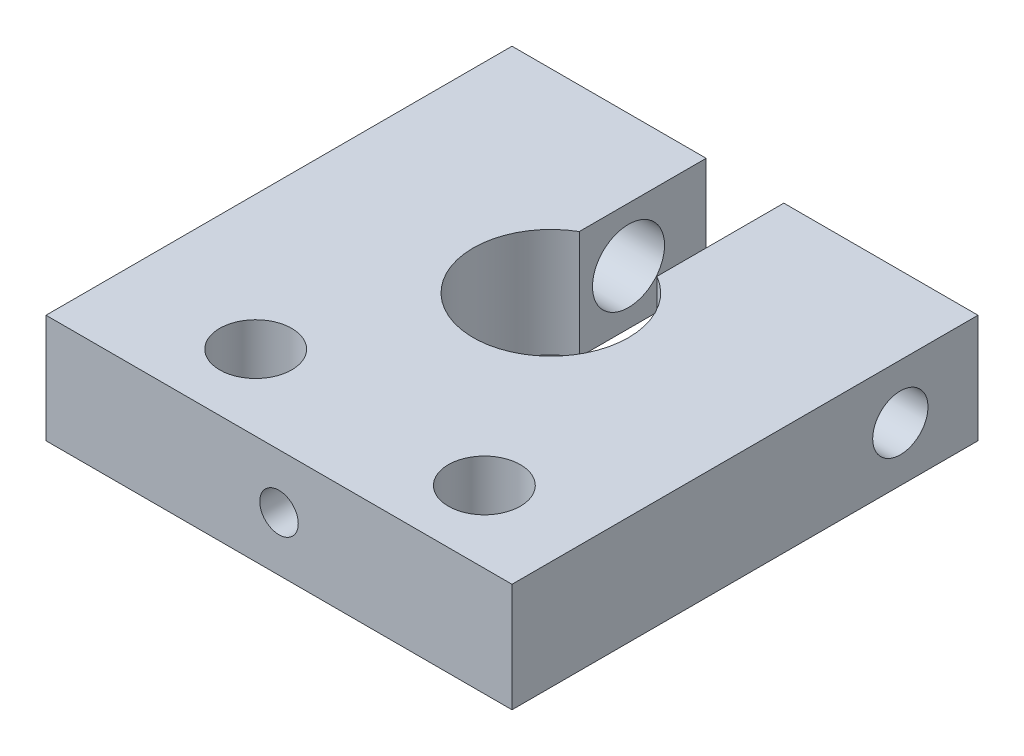
from build123d import *

# Parameters (mm, degrees)
SKETCH1_W           = 19.05
SKETCH1_H           = 19.05
SKETCH1_R           = 3.175
BOSS_EXTRUDE1_DEPTH = 4.445
SKETCH2_R           = 1.4732
SKETCH2_W           = 3.175
SKETCH2_H           = 5.187869343
CUT_EXTRUDE1_DEPTH  = 16.296120627
SKETCH4_R           = 0.7874
CUT_EXTRUDE3_DEPTH  = 22.757438958
SKETCH6_R           = 1.1303
CUT_EXTRUDE5_DEPTH  = 16.296120729
SKETCH7_R           = 1.4732
CUT_EXTRUDE6_DEPTH  = 16.296120729


with BuildPart() as part:
    # Sketch1 → Boss-Extrude1 (new body)
    with BuildSketch(Plane(origin=(0, 0, 0), x_dir=(1, 0, 0), z_dir=(0, 1, 0))):
        with Locations((0, -1.5875)):
            Rectangle(SKETCH1_W, SKETCH1_H)
        with Locations(Location((0, 0, 0), (0, 0, 270))):
            Circle(SKETCH1_R, mode=Mode.SUBTRACT)
    extrude(amount=BOSS_EXTRUDE1_DEPTH)

    # Sketch2 → Cut-Extrude1 (cut, through all)
    with BuildSketch(Plane(origin=(0, 4.445, 0), x_dir=(1, 0, 0), z_dir=(0, 1, 0))):
        with Locations(Location((5.461, -8.1788, 0), (0, 0, 270))):
            Circle(SKETCH2_R)
        with Locations(Location((-4.0386, -8.0264, 0), (0, 0, 270))):
            Circle(SKETCH2_R)
        with Locations((0, 5.343565329)):
            Rectangle(SKETCH2_W, SKETCH2_H)
    extrude(amount=-CUT_EXTRUDE1_DEPTH, mode=Mode.SUBTRACT)

    # Sketch4 → Cut-Extrude3 (cut, through all)
    with BuildSketch(Plane.XY.offset(11.1125)):
        with Locations((0, 2.2225)):
            Circle(SKETCH4_R)
    extrude(amount=-CUT_EXTRUDE3_DEPTH, mode=Mode.SUBTRACT)

    # Sketch6 → Cut-Extrude5 (cut, through all)
    with BuildSketch(Plane(origin=(0, 0, 0), x_dir=(0, 0, -1), z_dir=(1, 0, 0))):
        with Locations(Location((4.7625, 2.2225, 0), (0, 0, 180))):
            Circle(SKETCH6_R)
    extrude(amount=CUT_EXTRUDE5_DEPTH, mode=Mode.SUBTRACT)

    # Sketch7 → Cut-Extrude6 (cut, through all)
    with BuildSketch(Plane(origin=(0, 0, 0), x_dir=(0, 0, -1), z_dir=(1, 0, 0))):
        with Locations((4.7625, 2.2225)):
            Circle(SKETCH7_R)
    extrude(amount=-CUT_EXTRUDE6_DEPTH, mode=Mode.SUBTRACT)


solid = part.part
